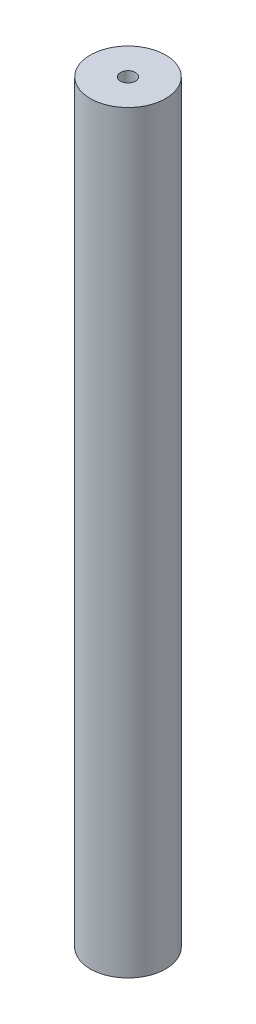
from build123d import *

# Parameters (mm, degrees)
SKETCH1_R           = 50
SKETCH1_R_2         = 10
BOSS_EXTRUDE1_DEPTH = 1000


with BuildPart() as part:
    # Sketch1 → Boss-Extrude1 (new body)
    with BuildSketch(Plane(origin=(0, 0, 0), x_dir=(1, 0, 0), z_dir=(0, 1, 0))):
        with Locations(Location((0, 0, 0), (0, 0, 270))):
            Circle(SKETCH1_R)
        with Locations(Location((0, 0, 0), (0, 0, 270))):
            Circle(SKETCH1_R_2, mode=Mode.SUBTRACT)
    extrude(amount=BOSS_EXTRUDE1_DEPTH)


solid = part.part
